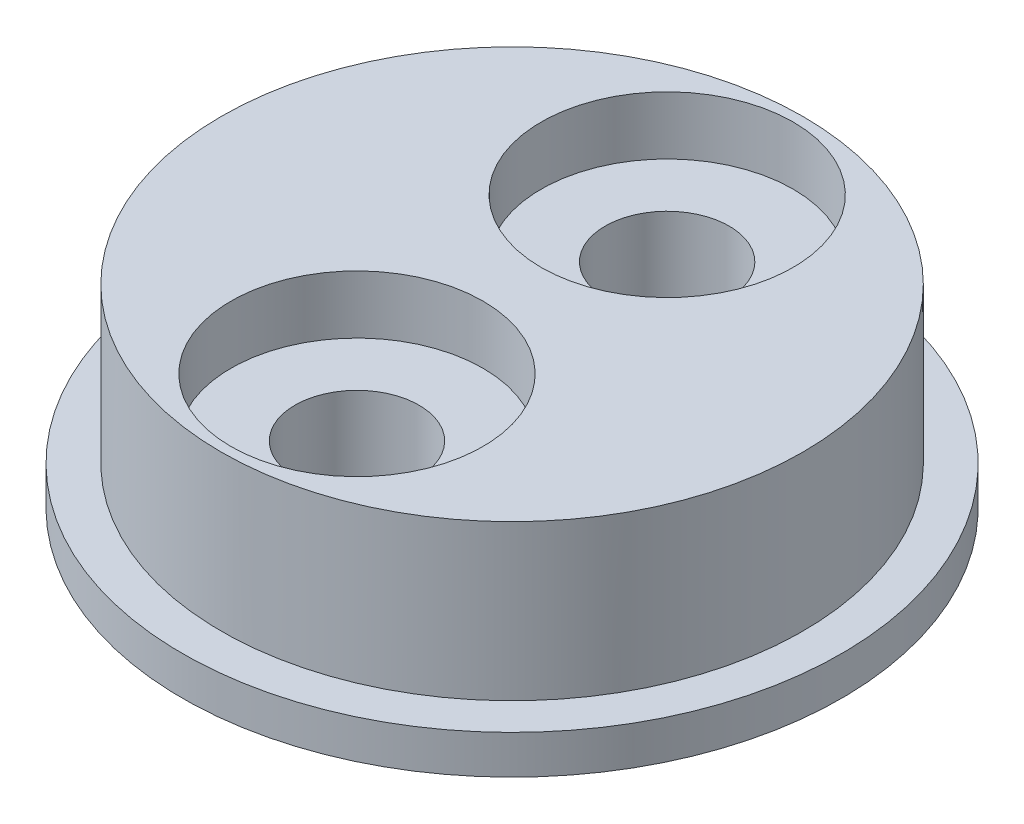
from build123d import *

# Parameters (mm, degrees)
SKETCH1_R           = 7.5
BOSS_EXTRUDE1_DEPTH = 5
SKETCH2_R           = 3.25
CUT_EXTRUDE1_DEPTH  = 1.5
SKETCH4_R           = 8.5
BOSS_EXTRUDE2_DEPTH = 1
SKETCH3_R           = 1.6
CUT_EXTRUDE2_DEPTH  = 14.019216566


with BuildPart() as part:
    # Sketch1 → Boss-Extrude1 (new body)
    with BuildSketch(Plane(origin=(0, 0, 0), x_dir=(1, 0, 0), z_dir=(0, 1, 0))):
        with Locations(Location((0, 0, 0), (0, 0, 270))):
            Circle(SKETCH1_R)
    extrude(amount=BOSS_EXTRUDE1_DEPTH)

    # Sketch2 → Cut-Extrude1 (cut)
    with BuildSketch(Plane(origin=(0, 5, 0), x_dir=(1, 0, 0), z_dir=(0, 1, 0))):
        with Locations(Location((0, 4, 0), (0, 0, 270))):
            Circle(SKETCH2_R)
        with Locations(Location((0, -4, 0), (0, 0, 270))):
            Circle(SKETCH2_R)
    extrude(amount=-CUT_EXTRUDE1_DEPTH, mode=Mode.SUBTRACT)

    # Sketch4 → Boss-Extrude2 (add)
    with BuildSketch(Plane.XZ):
        with Locations(Location((0, 0, 0), (0, 0, 270))):
            Circle(SKETCH4_R)
    extrude(amount=-BOSS_EXTRUDE2_DEPTH)

    # Sketch3 → Cut-Extrude2 (cut, through all)
    with BuildSketch(Plane(origin=(0, 5, 0), x_dir=(1, 0, 0), z_dir=(0, 1, 0))):
        with Locations(Location((0, 4, 0), (0, 0, 270))):
            Circle(SKETCH3_R)
        with Locations(Location((0, -4, 0), (0, 0, 270))):
            Circle(SKETCH3_R)
    extrude(amount=-CUT_EXTRUDE2_DEPTH, mode=Mode.SUBTRACT)


solid = part.part
